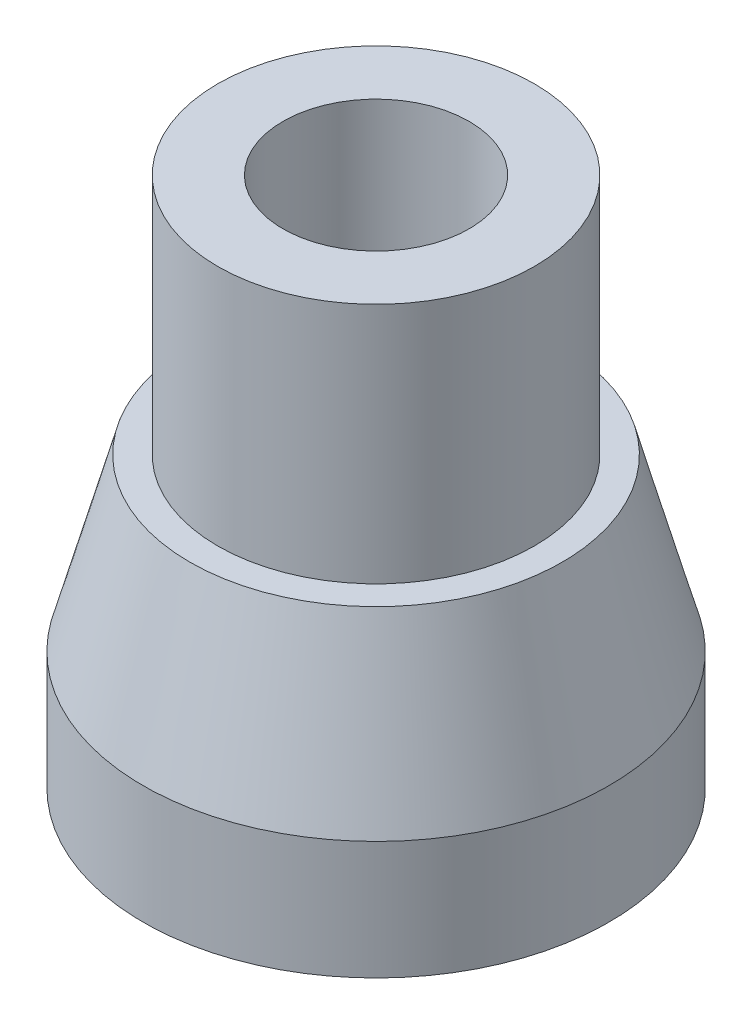
from build123d import *


with BuildPart() as part:
    # Sketch1 → Revolve1 (revolve)
    with BuildSketch(Plane.XY):
        Polygon((5, 28.5), (8.5, 28.5), (8.5, 15.5), (10, 15.5), (12.5, 6.35), (12.5, 0), (10.66166481, 0), (5, 20.721693206), align=None)
    revolve(axis=Axis((0, 0, 0), (0, 1, 0)))


solid = part.part
